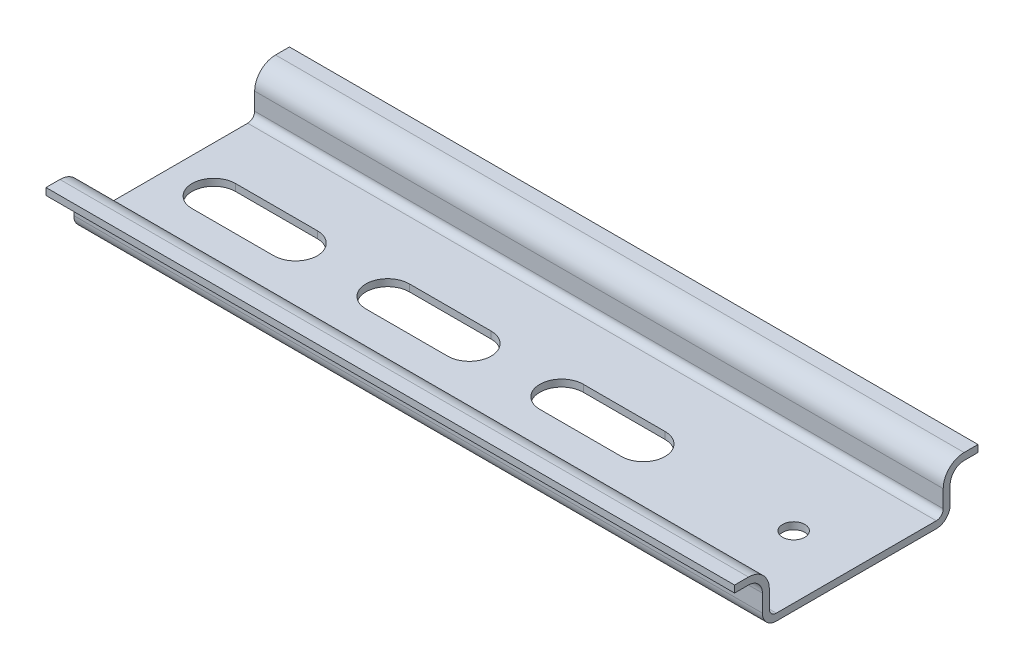
from build123d import *

# Parameters (mm, degrees)
EXTRUDE_THIN1_DEPTH        = 61.5
EXTRUDE_THIN1_DEPTH_BACK   = 37.5
CUT_EXTRUDE1_REACH         = 66.38
LPATTERN1_COUNT            = 2
LPATTERN1_PITCH            = 25
LPATTERN1_COL_COUNT        = 2
LPATTERN1_COL_PITCH        = 25
SZKIC1_R                   = 1.6
WYTNIJ_WYCI_GNI_CIE1_DEPTH = 65.379732836


with BuildPart() as part:
    # Sketch1 → Extrude-Thin1 (new, two sides: drawn at the far end of the back side and taken through both)
    with BuildSketch(Plane(origin=(0, 0, 0), x_dir=(0, 0, -1), z_dir=(1, 0, 0)).offset(-EXTRUDE_THIN1_DEPTH_BACK)):
        with BuildLine():
            Line((-17.5, 6.5), (-15.5, 6.5))
            ThreePointArc((-15.5, 6.5), (-14.085786438, 5.914213562), (-13.5, 4.5))
            Line((-13.5, 4.5), (-13.5, 2))
            ThreePointArc((-13.5, 2), (-12.914213562, 0.585786438), (-11.5, 0))
            Line((-11.5, 0), (11.5, 0))
            ThreePointArc((11.5, 0), (12.914213562, 0.585786438), (13.5, 2))
            Line((13.5, 2), (13.5, 4.5))
            ThreePointArc((13.5, 4.5), (14.085786438, 5.914213562), (15.5, 6.5))
            Line((15.5, 6.5), (17.5, 6.5))
            Line((17.5, 6.5), (17.5, 7.5))
            Line((17.5, 7.5), (15.5, 7.5))
            ThreePointArc((15.5, 7.5), (13.378679656, 6.621320344), (12.5, 4.5))
            Line((12.5, 4.5), (12.5, 2))
            ThreePointArc((12.5, 2), (12.207106781, 1.292893219), (11.5, 1))
            Line((11.5, 1), (-11.5, 1))
            ThreePointArc((-11.5, 1), (-12.207106781, 1.292893219), (-12.5, 2))
            Line((-12.5, 2), (-12.5, 4.5))
            ThreePointArc((-12.5, 4.5), (-13.378679656, 6.621320344), (-15.5, 7.5))
            Line((-15.5, 7.5), (-17.5, 7.5))
            Line((-17.5, 7.5), (-17.5, 6.5))
        make_face()
    extrude(amount=EXTRUDE_THIN1_DEPTH + EXTRUDE_THIN1_DEPTH_BACK)

    # Sketch2 → Cut-Extrude1 (cut, up to next)
    with BuildSketch(Plane.XZ, mode=Mode.PRIVATE) as cut_extrude1_sk1:
        with BuildLine():
            Line((-5.875, 3.125), (5.875, 3.125))
            ThreePointArc((5.875, 3.125), (9, 0), (5.875, -3.125))
            Line((5.875, -3.125), (-5.875, -3.125))
            ThreePointArc((-5.875, -3.125), (-9, 0), (-5.875, 3.125))
        make_face()
    cut_extrude1_tool1 = extrude(cut_extrude1_sk1.sketch, amount=-CUT_EXTRUDE1_REACH, mode=Mode.PRIVATE) & part.part
    cut_extrude1 = cut_extrude1_tool1.solids().sort_by_distance((0, 0, 0))[0]
    add(cut_extrude1, mode=Mode.SUBTRACT)

    # LPattern1: Cut-Extrude1 ×2
    with Locations(*[(i * LPATTERN1_PITCH, 0, 0) for i in range(1, LPATTERN1_COUNT)]):
        add(cut_extrude1, mode=Mode.SUBTRACT)

    # LPattern1 col: Cut-Extrude1 ×2
    with Locations(*[(-i * LPATTERN1_COL_PITCH, 0, 0) for i in range(1, LPATTERN1_COL_COUNT)]):
        add(cut_extrude1, mode=Mode.SUBTRACT)

    # Szkic1 → Wytnij-wyciągnięcie1 (cut, through all)
    with BuildSketch(Plane.XZ):
        with Locations(Location((52.5, 0, 0), (0, 0, 270))):
            Circle(SZKIC1_R)
    extrude(amount=-WYTNIJ_WYCI_GNI_CIE1_DEPTH, mode=Mode.SUBTRACT)


solid = part.part
